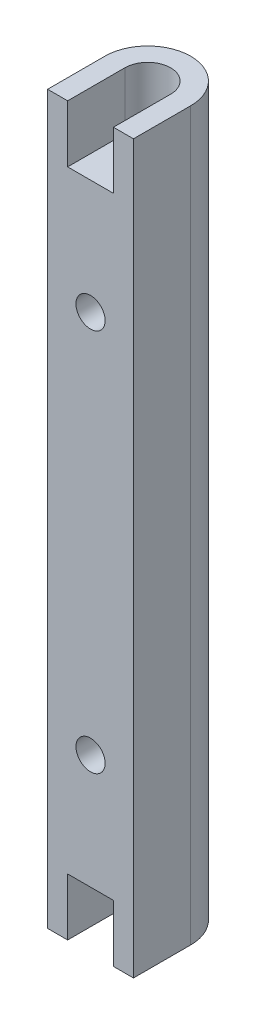
from build123d import *

# Parameters (mm, degrees)
EXTRUDE_1_DEPTH     = 127
SKETCH_6_R          = 2.55
CUT_EXTRUDE_1_DEPTH = 14.5
SKETCH_7_R          = 5
CUT_EXTRUDE_2_DEPTH = 14.5
CUT_EXTRUDE_3_DEPTH = 10
SKETCH_9_R          = 2.55
CUT_EXTRUDE_4_DEPTH = 14.5
SKETCH_10_R         = 5
CUT_EXTRUDE_5_DEPTH = 14.5
CUT_EXTRUDE_START   = -10
CUT_EXTRUDE_6_DEPTH = 10


with BuildPart() as part:
    # Эскиз2 → Бобышка-Вытянуть1 (new body)
    with BuildSketch(Plane(origin=(0, 0, 0), x_dir=(1, 0, 0), z_dir=(0, 1, 0))):
        with BuildLine():
            Line((0, 0), (0, -10))
            Line((0, -10), (15, -10))
            Line((15, -10), (15, 0))
            ThreePointArc((15, 0), (7.5, 7.5), (0, 0))
        make_face()
    extrude(amount=EXTRUDE_1_DEPTH)

    # Эскиз6 → Вырез-Вытянуть1 (cut)
    with BuildSketch(Plane.XY.offset(10)):
        with Locations((7.5, 30)):
            Circle(SKETCH_6_R)
    extrude(amount=-CUT_EXTRUDE_1_DEPTH, mode=Mode.SUBTRACT)

    # Эскиз7 → Вырез-Вытянуть2 (cut)
    with BuildSketch(Plane.XY.offset(-4.5)):
        with Locations((7.5, 30)):
            Circle(SKETCH_7_R)
    extrude(amount=-CUT_EXTRUDE_2_DEPTH, mode=Mode.SUBTRACT)

    # Эскиз8 → Вырез-Вытянуть3 (cut)
    with BuildSketch(Plane.XZ):
        with BuildLine():
            Line((11.5, 0), (11.5, 10))
            Line((11.5, 10), (3.5, 10))
            Line((3.5, 10), (3.5, 0))
            ThreePointArc((3.5, 0), (7.5, -4), (11.5, 0))
        make_face()
    extrude(amount=-CUT_EXTRUDE_3_DEPTH, mode=Mode.SUBTRACT)

    # Эскиз9 → Вырез-Вытянуть4 (cut)
    with BuildSketch(Plane.XY.offset(10)):
        with Locations((7.5, 97)):
            Circle(SKETCH_9_R)
    extrude(amount=-CUT_EXTRUDE_4_DEPTH, mode=Mode.SUBTRACT)

    # Эскиз10 → Вырез-Вытянуть5 (cut)
    with BuildSketch(Plane.XY.offset(-4.5)):
        with Locations((7.5, 97)):
            Circle(SKETCH_10_R)
    extrude(amount=-CUT_EXTRUDE_5_DEPTH, mode=Mode.SUBTRACT)

    # Эскиз11 → Вырез-Вытянуть6 (cut)
    with BuildSketch(Plane(origin=(0, 127, 0), x_dir=(1, 0, 0), z_dir=(0, 1, 0)).offset(CUT_EXTRUDE_START)):
        with BuildLine():
            Line((11.5, 0), (11.5, -10))
            Line((11.5, -10), (3.5, -10))
            Line((3.5, -10), (3.5, 0))
            ThreePointArc((3.5, 0), (7.5, 4), (11.5, 0))
        make_face()
    extrude(amount=CUT_EXTRUDE_6_DEPTH, mode=Mode.SUBTRACT)


solid = part.part
